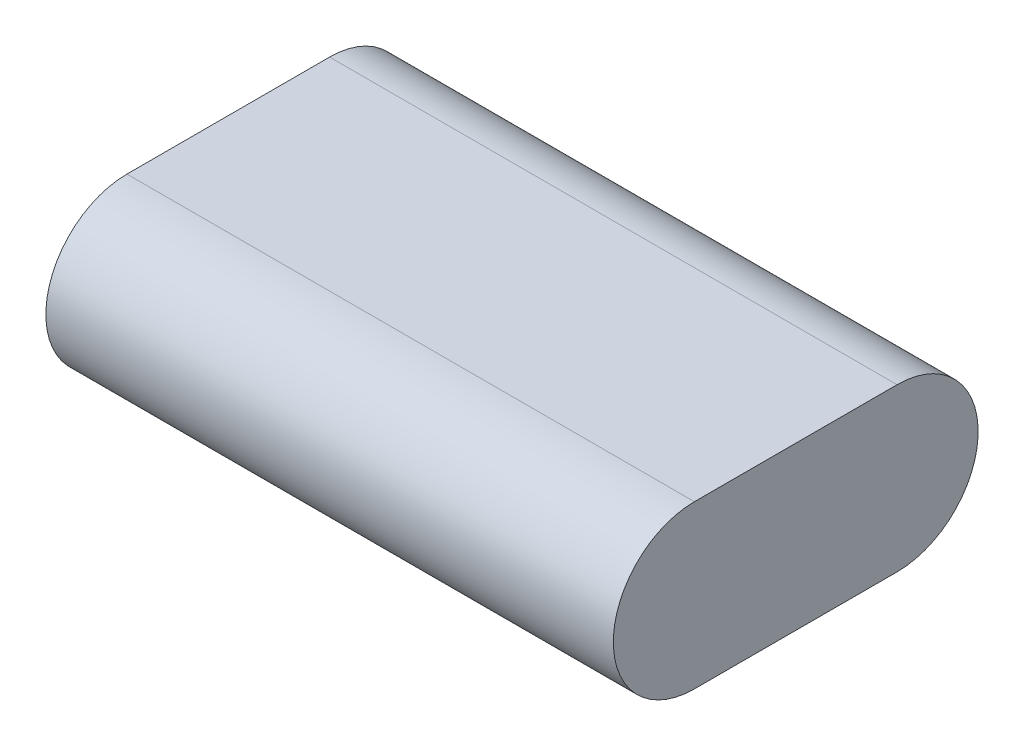
from build123d import *

# Parameters (mm, degrees)
BOSS_EXTRUDE1_DEPTH = 14


with BuildPart() as part:
    # Sketch1 → Boss-Extrude1 (new body)
    with BuildSketch(Plane(origin=(0, 0, 0), x_dir=(0, 0, -1), z_dir=(1, 0, 0))):
        with BuildLine():
            Line((0, 0), (5, 0))
            ThreePointArc((5, 0), (7, 2), (5, 4))
            Line((5, 4), (0, 4))
            ThreePointArc((0, 4), (-2, 2), (0, 0))
        make_face()
    extrude(amount=BOSS_EXTRUDE1_DEPTH)


solid = part.part
